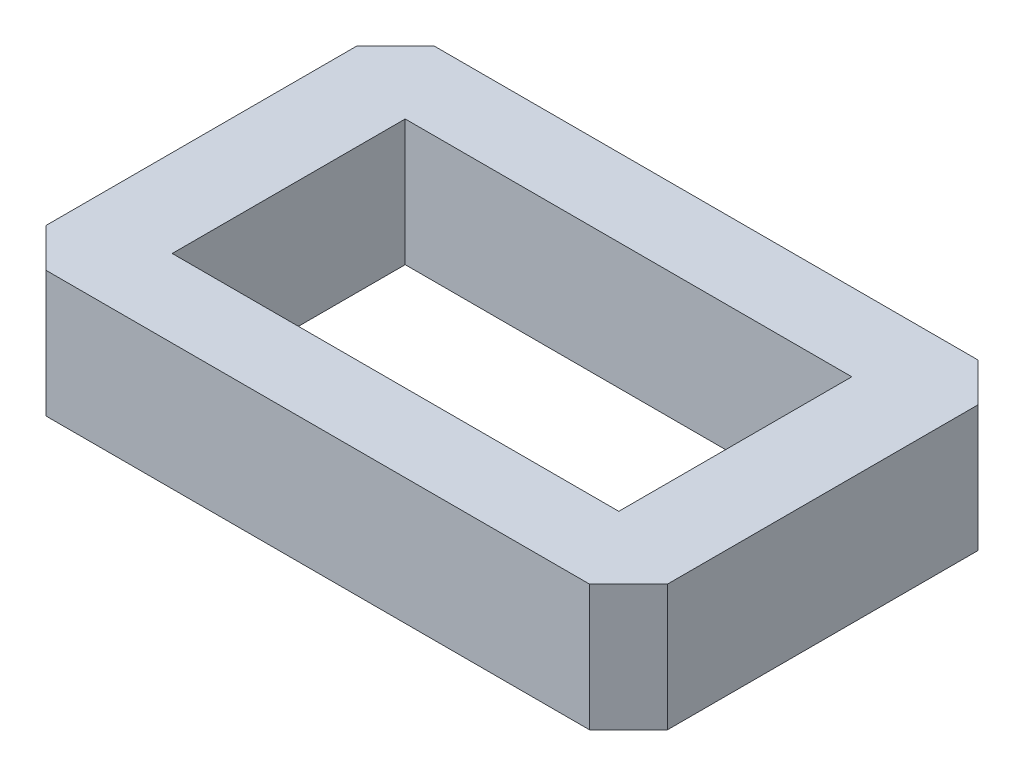
from build123d import *

# Parameters (mm, degrees)
SKETCH1_W           = 32
SKETCH1_H           = 20
BOSS_EXTRUDE1_DEPTH = 6.5
SKETCH2_W           = 23
SKETCH2_H           = 12
CUT_EXTRUDE1_DEPTH  = 39.291643997
CHAMFER1_SIZE       = 2


with BuildPart() as part:
    # Sketch1 → Boss-Extrude1 (new body)
    with BuildSketch(Plane(origin=(0, 0, 0), x_dir=(1, 0, 0), z_dir=(0, 1, 0))):
        with Locations((16, 10)):
            Rectangle(SKETCH1_W, SKETCH1_H)
    extrude(amount=BOSS_EXTRUDE1_DEPTH)

    # Sketch2 → Cut-Extrude1 (cut, through all)
    with BuildSketch(Plane(origin=(0, 6.5, 0), x_dir=(1, 0, 0), z_dir=(0, 1, 0))):
        with Locations((16, 10)):
            Rectangle(SKETCH2_W, SKETCH2_H)
    extrude(amount=-CUT_EXTRUDE1_DEPTH, mode=Mode.SUBTRACT)

    # Chamfer1
    chamfer1_edges = [part.edges().sort_by_distance(p)[0] for p in [
        (0, 3.25, -20),
        (32, 3.25, -20),
        (32, 3.25, 0),
        (0, 3.25, 0),
    ]]
    chamfer(chamfer1_edges, length=CHAMFER1_SIZE)


solid = part.part
